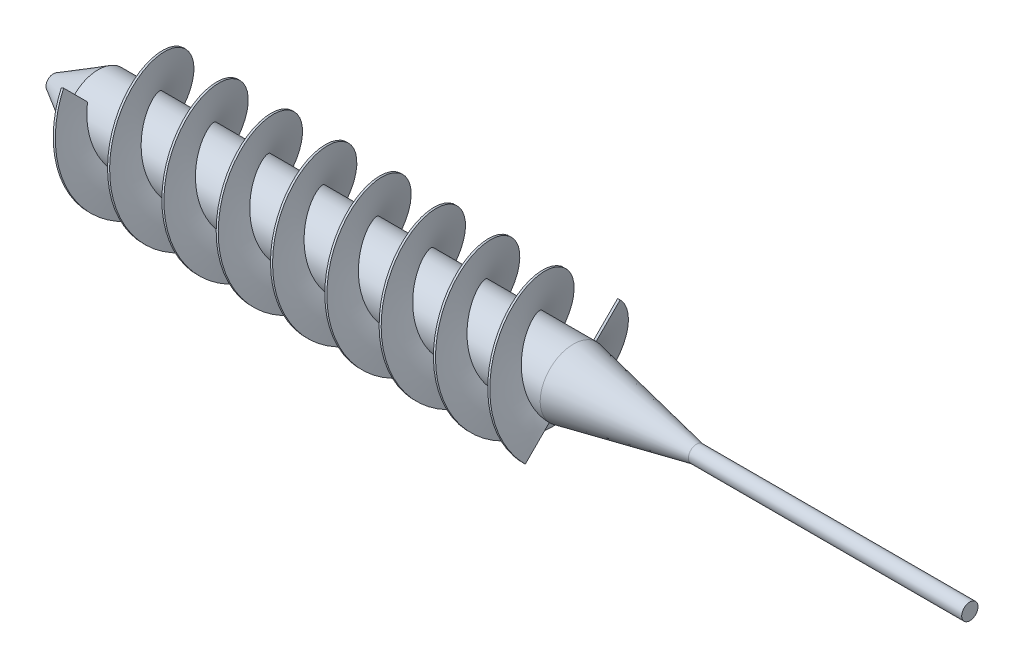
from build123d import *

# Parameters (mm, degrees)
SWEEP1_PITCH       = 160
SWEEP1_HEIGHT      = 680
SWEEP1_RADIUS      = 50
SWEEP1_START_ANGLE = -45
SKETCH4_W          = 3
SKETCH4_H          = 50
CIRPATTERN1_COUNT  = 2


with BuildPart() as part:
    # Sketch1 → Revolve3 (revolve)
    with BuildSketch(Plane.XY):
        Polygon((0, 0), (-1350, 0), (-1350, 10.799448809), (-1284.117875807, 48.799448809), (-584.117875807, 48.799448809), (-402.586695994, 12), (0, 12), align=None)
    revolve(axis=Axis((0, 0, 0), (-1, 0, 0)))


with BuildPart() as body_2:
    # Sweep1: sweep along a helix
    with BuildLine() as sweep1_path:
        add(Helix(SWEEP1_PITCH, SWEEP1_HEIGHT, SWEEP1_RADIUS, center=(-1265, 0, 0), direction=(1, 0, 0), mode=Mode.PRIVATE).rotate(Axis((-1265, 0, 0), (1, 0, 0)), SWEEP1_START_ANGLE))
    # Sketch4 → Sweep1 (sweep)
    with BuildSketch(Plane(origin=(-585, -35.355339059, 35.355339059), x_dir=(-0.8910892808215398, -0.32090488747051665, -0.3209048874705496), z_dir=(0.4538280440926399, -0.630095273111522, -0.6300952731115872))):
        with Locations((1.498222446, -23.799448809)):
            Rectangle(SKETCH4_W, SKETCH4_H)
    sweep(path=sweep1_path.line, is_frenet=True)


with BuildPart() as cirpattern1_1:
    # CirPattern1: pattern copy
    add(body_2.part.rotate(Axis((0, 0, 0), (1, 0, 0)), 1 * 360 / CIRPATTERN1_COUNT))


solid = Compound([part.part, body_2.part, cirpattern1_1.part])
